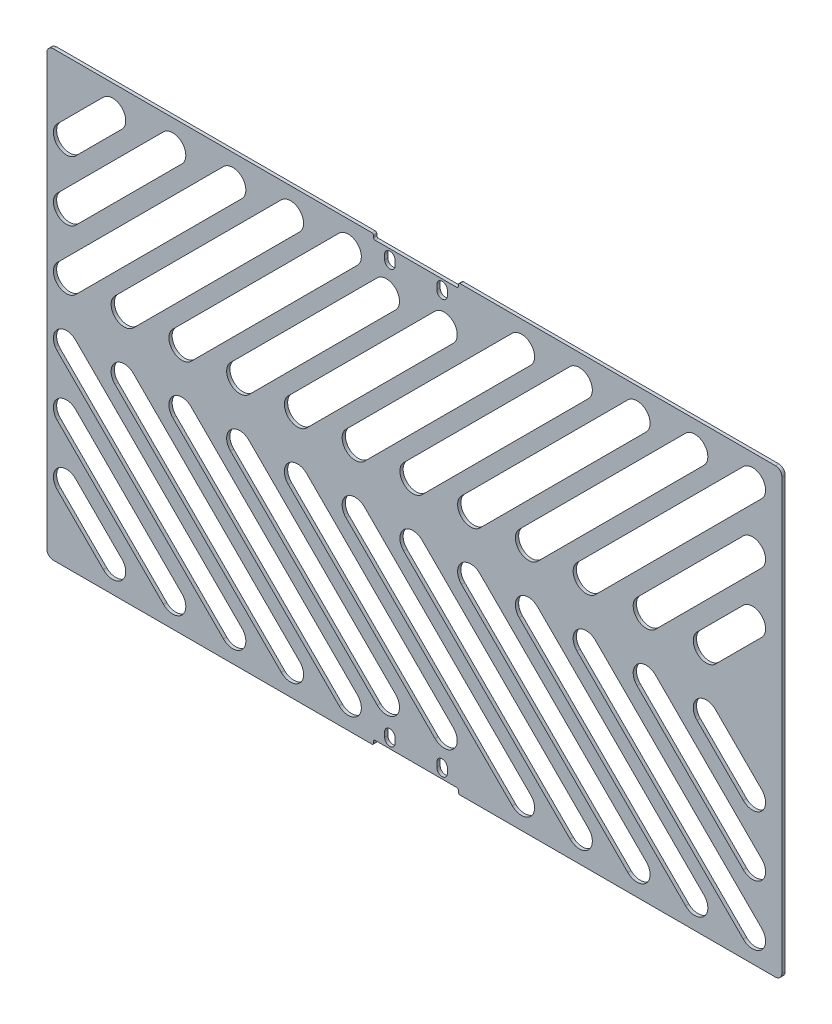
from build123d import *

# Parameters (mm, degrees)
SKETCH_1_W          = 225
SKETCH_1_H          = 135.6
EXTRUDE_1_DEPTH     = 1
SKETCH_2_W          = 26
SKETCH_2_H          = 3
CUT_EXTRUDE_1_DEPTH = 1
FILLET_1_R          = 0.5
SKETCH_5_R          = 4
CUT_EXTRUDE_4_DEPTH = 10
FILLET_2_R          = 2


with BuildPart() as part:
    # 草图1 → 凸台-拉伸1 (new body)
    with BuildSketch(Plane.XY):
        Rectangle(SKETCH_1_W, SKETCH_1_H)
    extrude(amount=EXTRUDE_1_DEPTH)

    # 草图2 → 切除-拉伸1 (cut)
    with BuildSketch(Plane.XY.offset(1)):
        with Locations((0.5, -67.8)):
            Rectangle(SKETCH_2_W, SKETCH_2_H)
        with BuildLine():
            Line((-9.1, -64.05), (-9.1, -62.55))
            ThreePointArc((-9.1, -62.55), (-7.5, -60.95), (-5.9, -62.55))
            Line((-5.9, -62.55), (-5.9, -64.05))
            ThreePointArc((-5.9, -64.05), (-7.5, -65.65), (-9.1, -64.05))
        make_face()
        with BuildLine():
            Line((10.1, -64.05), (10.1, -62.55))
            ThreePointArc((10.1, -62.55), (8.5, -60.95), (6.9, -62.55))
            Line((6.9, -62.55), (6.9, -64.05))
            ThreePointArc((6.9, -64.05), (8.5, -65.65), (10.1, -64.05))
        make_face()
    cut_extrude_1 = extrude(amount=-CUT_EXTRUDE_1_DEPTH, mode=Mode.SUBTRACT)

    # 镜向1: 切除-拉伸1 across plane
    add(cut_extrude_1.mirror(Plane.ZX), mode=Mode.SUBTRACT)

    # 圆角1
    fillet_1_edges = [part.edges().sort_by_distance(p)[0] for p in [
        (13.5, -67.8, 0.5),
        (13.5, -66.3, 0.5),
        (-12.5, -67.8, 0.5),
        (-12.5, -66.3, 0.5),
        (-12.5, 66.3, 0.5),
        (13.5, 67.8, 0.5),
        (13.5, 66.3, 0.5),
        (-12.5, 67.8, 0.5),
    ]]
    fillet(fillet_1_edges, radius=FILLET_1_R)

    # 草图5 → 切除-拉伸4 (cut)
    with BuildSketch(Plane.XY.offset(1)):
        with BuildLine():
            Line((-109.328427125, -48.486291501), (-95.186291501, -62.628427125))
            ThreePointArc((-95.186291501, -62.628427125), (-89.529437252, -62.628427125), (-89.529437252, -56.971572875))
            Line((-89.529437252, -56.971572875), (-103.671572875, -42.829437252))
            ThreePointArc((-103.671572875, -42.829437252), (-109.328427125, -42.829437252), (-109.328427125, -48.486291501))
        make_face()
        with BuildLine():
            Line((-109.328427125, -30.10151519), (-76.80151519, -62.628427125))
            ThreePointArc((-76.80151519, -62.628427125), (-71.144660941, -62.628427125), (-71.144660941, -56.971572875))
            Line((-71.144660941, -56.971572875), (-103.671572875, -24.444660941))
            ThreePointArc((-103.671572875, -24.444660941), (-109.328427125, -24.444660941), (-109.328427125, -30.10151519))
        make_face()
        with BuildLine():
            Line((-109.328427125, -11.716738879), (-58.416738879, -62.628427125))
            ThreePointArc((-58.416738879, -62.628427125), (-52.75988463, -62.628427125), (-52.75988463, -56.971572875))
            Line((-52.75988463, -56.971572875), (-103.671572875, -6.05988463))
            ThreePointArc((-103.671572875, -6.05988463), (-109.328427125, -6.05988463), (-109.328427125, -11.716738879))
        make_face()
        with BuildLine():
            Line((-91.650757595, -11.716738879), (-40.73906935, -62.628427125))
            ThreePointArc((-40.73906935, -62.628427125), (-35.0822151, -62.628427125), (-35.0822151, -56.971572875))
            Line((-35.0822151, -56.971572875), (-85.993903346, -6.05988463))
            ThreePointArc((-85.993903346, -6.05988463), (-91.650757595, -6.05988463), (-91.650757595, -11.716738879))
        make_face()
        with BuildLine():
            Line((-73.973088065, -11.716738879), (-23.06139982, -62.628427125))
            ThreePointArc((-23.06139982, -62.628427125), (-17.40454557, -62.628427125), (-17.40454557, -56.971572875))
            Line((-17.40454557, -56.971572875), (-68.316233816, -6.05988463))
            ThreePointArc((-68.316233816, -6.05988463), (-73.973088065, -6.05988463), (-73.973088065, -11.716738879))
        make_face()
        with BuildLine():
            Line((-5.726875997, -50.971572919), (-50.638564286, -6.05988463))
            ThreePointArc((-50.638564286, -6.05988463), (-56.295418536, -6.05988463), (-56.295418536, -11.716738879))
            Line((-56.295418536, -11.716738879), (-11.383730325, -56.62842709))
            ThreePointArc((-11.383730325, -56.62842709), (-11.383730251, -50.971572836), (-5.726875997, -50.971572919))
        make_face()
        with Locations((-8.555303166, -53.8)):
            Circle(SKETCH_5_R)
        with Locations((9.122366364, -53.8)):
            Circle(SKETCH_5_R)
        with BuildLine():
            Line((11.950793489, -50.971572875), (-32.960894757, -6.05988463))
            ThreePointArc((-32.960894757, -6.05988463), (-38.617749006, -6.05988463), (-38.617749006, -11.716738879))
            Line((-38.617749006, -11.716738879), (6.29393929, -56.628427175))
            ThreePointArc((6.29393929, -56.628427175), (6.293939214, -50.971572901), (11.950793489, -50.971572875))
        make_face()
        with BuildLine():
            Line((-20.940079476, -11.716738879), (29.971608769, -62.628427125))
            ThreePointArc((29.971608769, -62.628427125), (35.628463018, -62.628427125), (35.628463018, -56.971572875))
            Line((35.628463018, -56.971572875), (-15.283225227, -6.05988463))
            ThreePointArc((-15.283225227, -6.05988463), (-20.940079476, -6.05988463), (-20.940079476, -11.716738879))
        make_face()
        with BuildLine():
            Line((-3.262409947, -11.716738879), (47.649278299, -62.628427125))
            ThreePointArc((47.649278299, -62.628427125), (53.306132548, -62.628427125), (53.306132548, -56.971572875))
            Line((53.306132548, -56.971572875), (2.394444303, -6.05988463))
            ThreePointArc((2.394444303, -6.05988463), (-3.262409947, -6.05988463), (-3.262409947, -11.716738879))
        make_face()
        with BuildLine():
            Line((14.415259583, -11.716738879), (65.326947828, -62.628427125))
            ThreePointArc((65.326947828, -62.628427125), (70.983802078, -62.628427125), (70.983802078, -56.971572875))
            Line((70.983802078, -56.971572875), (20.072113832, -6.05988463))
            ThreePointArc((20.072113832, -6.05988463), (14.415259583, -6.05988463), (14.415259583, -11.716738879))
        make_face()
        with BuildLine():
            Line((32.092929113, -11.716738879), (83.004617358, -62.628427125))
            ThreePointArc((83.004617358, -62.628427125), (88.661471607, -62.628427125), (88.661471607, -56.971572875))
            Line((88.661471607, -56.971572875), (37.749783362, -6.05988463))
            ThreePointArc((37.749783362, -6.05988463), (32.092929113, -6.05988463), (32.092929113, -11.716738879))
        make_face()
        with BuildLine():
            Line((49.770598642, -11.716738879), (100.682286888, -62.628427125))
            ThreePointArc((100.682286888, -62.628427125), (106.339141137, -62.628427125), (106.339141137, -56.971572875))
            Line((106.339141137, -56.971572875), (55.427452892, -6.05988463))
            ThreePointArc((55.427452892, -6.05988463), (49.770598642, -6.05988463), (49.770598642, -11.716738879))
        make_face()
        with BuildLine():
            Line((68.155374953, -11.716738879), (100.682286888, -44.243650814))
            ThreePointArc((100.682286888, -44.243650814), (106.339141137, -44.243650814), (106.339141137, -38.586796564))
            Line((106.339141137, -38.586796564), (73.812229203, -6.05988463))
            ThreePointArc((73.812229203, -6.05988463), (68.155374953, -6.05988463), (68.155374953, -11.716738879))
        make_face()
        with BuildLine():
            Line((86.540151264, -11.716738879), (100.682286888, -25.858874503))
            ThreePointArc((100.682286888, -25.858874503), (106.339141137, -25.858874503), (106.339141137, -20.202020254))
            Line((106.339141137, -20.202020254), (92.197005513, -6.05988463))
            ThreePointArc((92.197005513, -6.05988463), (86.540151264, -6.05988463), (86.540151264, -11.716738879))
        make_face()
    cut_extrude_4 = extrude(amount=-CUT_EXTRUDE_4_DEPTH, mode=Mode.SUBTRACT)

    # 镜向2: 切除-拉伸4 across plane
    add(cut_extrude_4.mirror(Plane.ZX), mode=Mode.SUBTRACT)

    # 圆角2
    fillet_2_edges = [part.edges().sort_by_distance(p)[0] for p in [
        (112.5, -67.8, 0.5),
        (-112.5, -67.8, 0.5),
        (-112.5, 67.8, 0.5),
        (112.5, 67.8, 0.5),
    ]]
    fillet(fillet_2_edges, radius=FILLET_2_R)


solid = part.part
